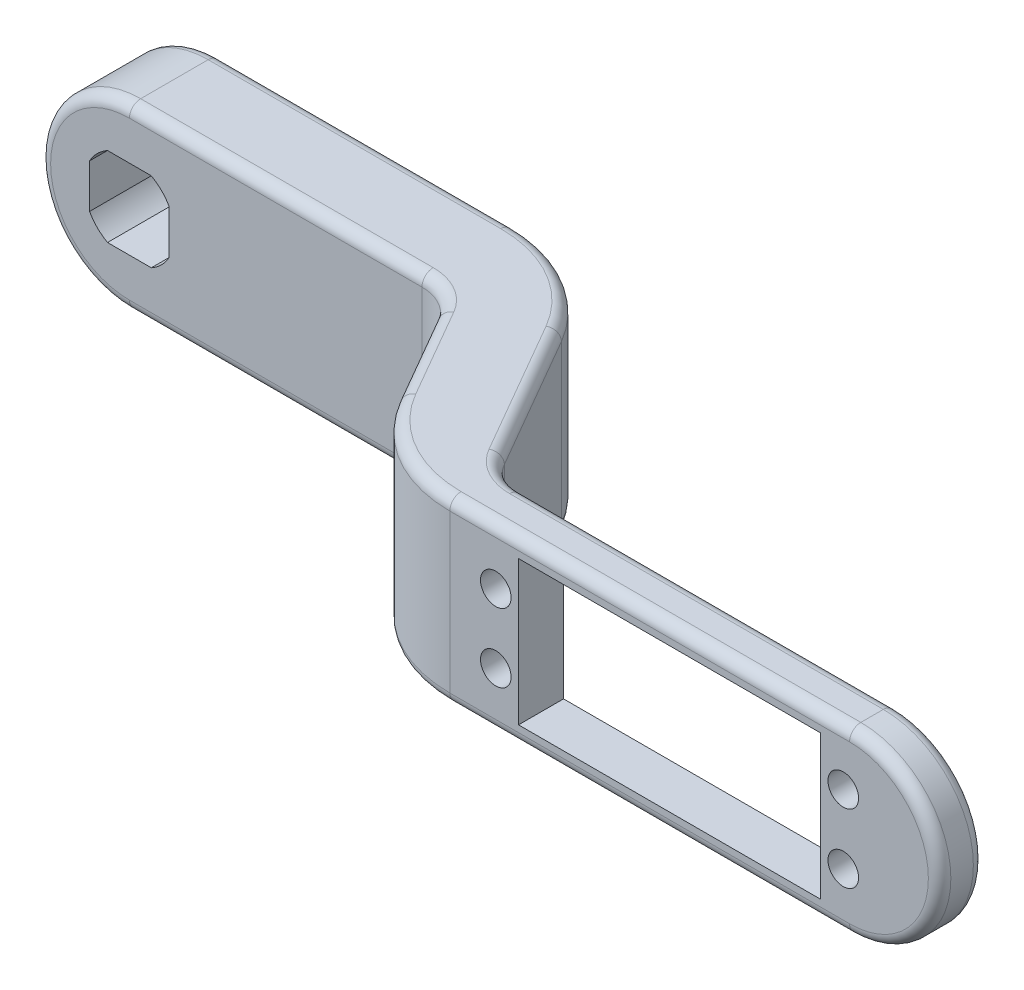
from build123d import *

# Parameters (mm, degrees)
BOSS_EXTRUDE1_DEPTH = 25.4
CUT_EXTRUDE1_DEPTH  = 25.4
CUT_EXTRUDE2_REACH  = 158.576
CUT_EXTRUDE6_REACH  = 161.131
CUT_EXTRUDE7_REACH  = 161.131
SKETCH8_R           = 2.159
SKETCH8_W           = 42.6085
SKETCH8_H           = 20.32
FILLET2_R           = 6.35
FILLET1_R           = 1.5875


with BuildPart() as part:
    # Sketch1 → Boss-Extrude1 (new body)
    with BuildSketch(Plane(origin=(0, 0, 0), x_dir=(1, 0, 0), z_dir=(0, 1, 0))):
        with BuildLine():
            Line((152.4, -25.4), (83.304393675, -25.4))
            Line((83.304393675, -25.4), (77.805132361, -15.875))
            Line((77.805132361, -15.875), (70.472783942, -3.175))
            ThreePointArc((70.472783942, -3.175), (63.5, 3.797783942), (53.975, 6.35))
            Line((53.975, 6.35), (0, 6.35))
            Line((0, 6.35), (0, -6.35))
            Line((0, -6.35), (53.975, -6.35))
            ThreePointArc((53.975, -6.35), (57.15, -7.200738686), (59.474261314, -9.525))
            Line((59.474261314, -9.525), (66.806609733, -22.225))
            ThreePointArc((66.806609733, -22.225), (73.779393675, -29.197783942), (83.304393675, -31.75))
            Line((83.304393675, -31.75), (152.4, -31.75))
            Line((152.4, -31.75), (152.4, -25.4))
        make_face()
    extrude(amount=BOSS_EXTRUDE1_DEPTH)

    # Sketch3 → Cut-Extrude1 (cut)
    with BuildSketch(Plane.XY.offset(6.35)):
        with BuildLine():
            ThreePointArc((7.08025, 9.609467329), (8.164970659, 8.164970659), (9.609467329, 7.08025))
            Line((9.609467329, 7.08025), (15.790532671, 7.08025))
            ThreePointArc((15.790532671, 7.08025), (17.235029341, 8.164970659), (18.31975, 9.609467329))
            Line((18.31975, 9.609467329), (18.31975, 15.790532671))
            ThreePointArc((18.31975, 15.790532671), (17.235029341, 17.235029341), (15.790532671, 18.31975))
            Line((15.790532671, 18.31975), (9.609467329, 18.31975))
            ThreePointArc((9.609467329, 18.31975), (8.164970659, 17.235029341), (7.08025, 15.790532671))
            Line((7.08025, 15.790532671), (7.08025, 9.609467329))
        make_face()
    extrude(amount=-CUT_EXTRUDE1_DEPTH, mode=Mode.SUBTRACT)

    # Sketch4 → Cut-Extrude2 (cut, up to next)
    with BuildSketch(Plane.XY.offset(6.35), mode=Mode.PRIVATE) as cut_extrude2_sk1:
        with BuildLine():
            Line((0, 12.7), (0, 0))
            Line((0, 0), (12.7, 0))
            ThreePointArc((12.7, 0), (3.719743879, 3.719743879), (0, 12.7))
        make_face()
    cut_extrude2_tool1 = extrude(cut_extrude2_sk1.sketch, amount=-CUT_EXTRUDE2_REACH, mode=Mode.PRIVATE) & part.part
    # Sketch4 → Cut-Extrude2 (cut, up to next)
    with BuildSketch(Plane.XY.offset(6.35), mode=Mode.PRIVATE) as cut_extrude2_sk2:
        with BuildLine():
            Line((0, 25.4), (0, 12.7))
            ThreePointArc((0, 12.7), (3.719743879, 21.680256121), (12.7, 25.4))
            Line((12.7, 25.4), (0, 25.4))
        make_face()
    cut_extrude2_tool2 = extrude(cut_extrude2_sk2.sketch, amount=-CUT_EXTRUDE2_REACH, mode=Mode.PRIVATE) & part.part
    add(cut_extrude2_tool1.solids().sort_by_distance((2.836773, 2.836773, 6.35))[0], mode=Mode.SUBTRACT)
    add(cut_extrude2_tool2.solids().sort_by_distance((2.836773, 22.563227, 6.35))[0], mode=Mode.SUBTRACT)

    # Sketch7 → Cut-Extrude6 (cut, up to next)
    with BuildSketch(Plane.XY.offset(31.75), mode=Mode.PRIVATE) as cut_extrude6_sk1:
        with BuildLine():
            ThreePointArc((139.7, 25.4), (148.680256121, 21.680256121), (152.4, 12.7))
            Line((152.4, 12.7), (152.4, 25.4))
            Line((152.4, 25.4), (139.7, 25.4))
        make_face()
    cut_extrude6_tool1 = extrude(cut_extrude6_sk1.sketch, amount=-CUT_EXTRUDE6_REACH, mode=Mode.PRIVATE) & part.part
    # Sketch7 → Cut-Extrude6 (cut, up to next)
    with BuildSketch(Plane.XY.offset(31.75), mode=Mode.PRIVATE) as cut_extrude6_sk2:
        with BuildLine():
            ThreePointArc((152.4, 12.7), (148.680256121, 3.719743879), (139.7, 0))
            Line((139.7, 0), (152.4, 0))
            Line((152.4, 0), (152.4, 12.7))
        make_face()
    cut_extrude6_tool2 = extrude(cut_extrude6_sk2.sketch, amount=-CUT_EXTRUDE6_REACH, mode=Mode.PRIVATE) & part.part
    add(cut_extrude6_tool1.solids().sort_by_distance((149.563227, 22.563227, 31.75))[0], mode=Mode.SUBTRACT)
    add(cut_extrude6_tool2.solids().sort_by_distance((149.563227, 2.836773, 31.75))[0], mode=Mode.SUBTRACT)

    # Sketch8 → Cut-Extrude7 (cut, up to next)
    with BuildSketch(Plane.XY.offset(31.75), mode=Mode.PRIVATE) as cut_extrude7_sk1:
        with Locations((138.811, 7.8486)):
            Circle(SKETCH8_R)
    cut_extrude7_tool1 = extrude(cut_extrude7_sk1.sketch, amount=-CUT_EXTRUDE7_REACH, mode=Mode.PRIVATE) & part.part
    # Sketch8 → Cut-Extrude7 (cut, up to next)
    with BuildSketch(Plane.XY.offset(31.75), mode=Mode.PRIVATE) as cut_extrude7_sk2:
        with Locations(Location((138.811, 17.5514, 0), (0, 0, 180))):
            Circle(SKETCH8_R)
    cut_extrude7_tool2 = extrude(cut_extrude7_sk2.sketch, amount=-CUT_EXTRUDE7_REACH, mode=Mode.PRIVATE) & part.part
    # Sketch8 → Cut-Extrude7 (cut, up to next)
    with BuildSketch(Plane.XY.offset(31.75), mode=Mode.PRIVATE) as cut_extrude7_sk3:
        with Locations(Location((89.789, 7.8486, 0), (0, 0, 180))):
            Circle(SKETCH8_R)
    cut_extrude7_tool3 = extrude(cut_extrude7_sk3.sketch, amount=-CUT_EXTRUDE7_REACH, mode=Mode.PRIVATE) & part.part
    # Sketch8 → Cut-Extrude7 (cut, up to next)
    with BuildSketch(Plane.XY.offset(31.75), mode=Mode.PRIVATE) as cut_extrude7_sk4:
        with Locations((89.789, 17.5514)):
            Circle(SKETCH8_R)
    cut_extrude7_tool4 = extrude(cut_extrude7_sk4.sketch, amount=-CUT_EXTRUDE7_REACH, mode=Mode.PRIVATE) & part.part
    # Sketch8 → Cut-Extrude7 (cut, up to next)
    with BuildSketch(Plane.XY.offset(31.75), mode=Mode.PRIVATE) as cut_extrude7_sk5:
        with Locations((114.3, 12.7)):
            Rectangle(SKETCH8_W, SKETCH8_H)
    cut_extrude7_tool5 = extrude(cut_extrude7_sk5.sketch, amount=-CUT_EXTRUDE7_REACH, mode=Mode.PRIVATE) & part.part
    add(cut_extrude7_tool1.solids().sort_by_distance((138.811, 7.8486, 31.75))[0], mode=Mode.SUBTRACT)
    add(cut_extrude7_tool2.solids().sort_by_distance((138.811, 17.5514, 31.75))[0], mode=Mode.SUBTRACT)
    add(cut_extrude7_tool3.solids().sort_by_distance((89.789, 7.8486, 31.75))[0], mode=Mode.SUBTRACT)
    add(cut_extrude7_tool4.solids().sort_by_distance((89.789, 17.5514, 31.75))[0], mode=Mode.SUBTRACT)
    add(cut_extrude7_tool5.solids().sort_by_distance((114.3, 12.7, 31.75))[0], mode=Mode.SUBTRACT)

    # Fillet2
    fillet2_edges = [part.edges().sort_by_distance(p)[0] for p in [
        (83.304393675, 12.7, 25.4),
    ]]
    fillet(fillet2_edges, radius=FILLET2_R)

    # Fillet1
    fillet1_edges = [part.edges().sort_by_distance(p)[0] for p in [
        (75.972045256, 0, 12.7),
        (111.502196837, 0, 31.75),
        (113.335283942, 25.4, 25.4),
        (113.335283942, 0, 25.4),
        (83.795567884, 0, 24.549261314),
        (83.795567884, 25.4, 24.549261314),
        (73.779393675, 0, 29.197783942),
        (63.140435523, 0, 15.875),
        (57.15, 0, 7.200738686),
        (63.5, 0, -3.797783942),
        (57.15, 25.4, 7.200738686),
        (63.140435523, 25.4, 15.875),
        (73.779393675, 25.4, 29.197783942),
        (111.502196837, 25.4, 31.75),
        (75.972045256, 25.4, 12.7),
        (63.5, 25.4, -3.797783942),
        (33.3375, 25.4, -6.35),
        (33.3375, 25.4, 6.35),
        (0, 12.7, 6.35),
        (0, 12.7, -6.35),
        (33.3375, 0, 6.35),
        (33.3375, 0, -6.35),
        (152.4, 12.7, 31.75),
        (152.4, 12.7, 25.4),
    ]]
    fillet(fillet1_edges, radius=FILLET1_R)


solid = part.part
